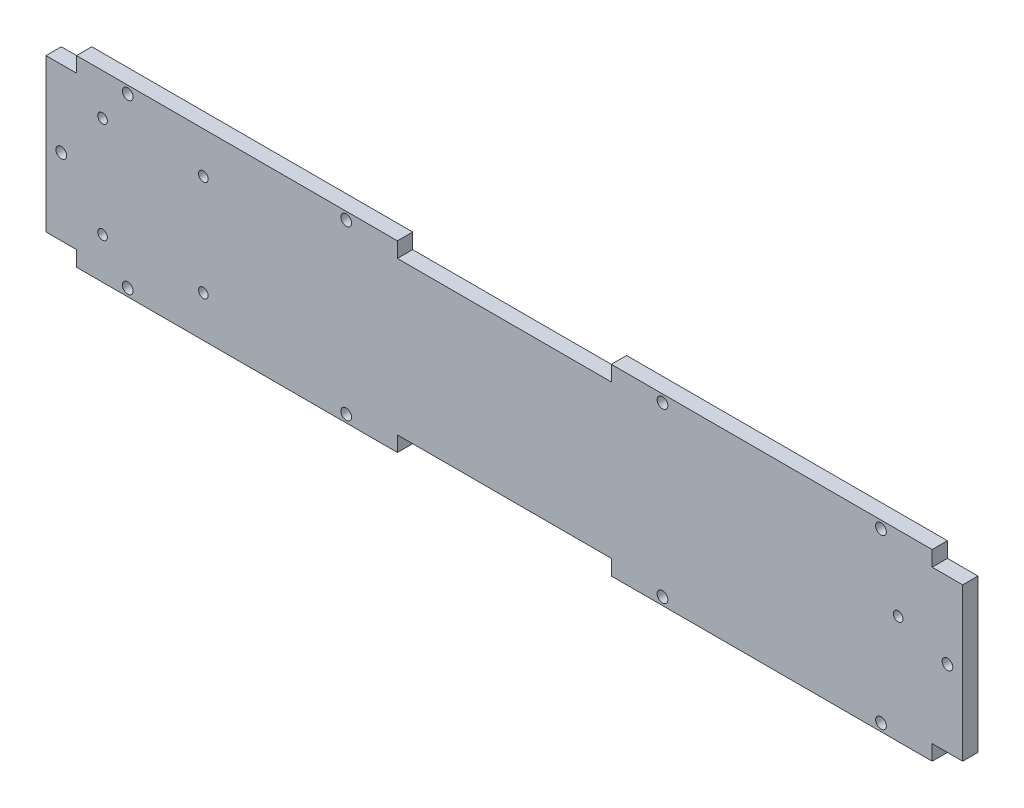
from build123d import *

# Parameters (mm, degrees)
SKETCH1_W           = 105
SKETCH1_H           = 5
SKETCH1_W_2         = 10
SKETCH1_H_2         = 50
BOSS_EXTRUDE1_DEPTH = 5
SKETCH2_R           = 1.75
CUT_EXTRUDE1_DEPTH  = 5
SKETCH3_R           = 1.75
CUT_EXTRUDE2_DEPTH  = 10
SKETCH5_R           = 1.575
CUT_EXTRUDE4_DEPTH  = 160.843673631


with BuildPart() as part:
    # Sketch1 → Boss-Extrude1 (new body)
    with BuildSketch(Plane.XY):
        Polygon((-35, 0), (0, 0), (0, 50), (-35, 50), (-140, 50), (-140, 0), align=None)
        Polygon((0, 50), (0, 0), (35, 0), (140, 0), (140, 50), (35, 50), align=None)
        with Locations((-87.5, -2.5)):
            Rectangle(SKETCH1_W, SKETCH1_H)
        with Locations((87.5, -2.5)):
            Rectangle(SKETCH1_W, SKETCH1_H)
        with Locations((-87.5, 52.5)):
            Rectangle(SKETCH1_W, SKETCH1_H)
        with Locations((87.5, 52.5)):
            Rectangle(SKETCH1_W, SKETCH1_H)
        with Locations((-145, 25)):
            Rectangle(SKETCH1_W_2, SKETCH1_H_2)
        with Locations((145, 25)):
            Rectangle(SKETCH1_W_2, SKETCH1_H_2)
    extrude(amount=BOSS_EXTRUDE1_DEPTH)

    # Sketch2 → Cut-Extrude1 (cut)
    with BuildSketch(Plane.XY.offset(5)):
        with Locations((-123.25, -2.5)):
            Circle(SKETCH2_R)
        with Locations(Location((-51.75, -2.5, 0), (0, 0, 180))):
            Circle(SKETCH2_R)
        with Locations((51.75, -2.5)):
            Circle(SKETCH2_R)
        with Locations(Location((123.25, -2.5, 0), (0, 0, 180))):
            Circle(SKETCH2_R)
        with Locations((123.25, 52.5)):
            Circle(SKETCH2_R)
        with Locations(Location((51.75, 52.5, 0), (0, 0, 180))):
            Circle(SKETCH2_R)
        with Locations((-51.75, 52.5)):
            Circle(SKETCH2_R)
        with Locations(Location((-123.25, 52.5, 0), (0, 0, 180))):
            Circle(SKETCH2_R)
    extrude(amount=-CUT_EXTRUDE1_DEPTH, mode=Mode.SUBTRACT)

    # Sketch3 → Cut-Extrude2 (cut)
    with BuildSketch(Plane.XY.offset(5)):
        with Locations((-145, 25)):
            Circle(SKETCH3_R)
        with Locations((145, 25)):
            Circle(SKETCH3_R)
    extrude(amount=-CUT_EXTRUDE2_DEPTH, mode=Mode.SUBTRACT)

    # Sketch5 → Cut-Extrude4 (cut, through all)
    with BuildSketch(Plane.XY.offset(5)):
        with Locations((-131.5, 41.5)):
            Circle(SKETCH5_R)
        with Locations(Location((-98.5, 41.5, 0), (0, 0, 180))):
            Circle(SKETCH5_R)
        with Locations((-98.5, 8.5)):
            Circle(SKETCH5_R)
        with Locations(Location((-131.5, 8.5, 0), (0, 0, 180))):
            Circle(SKETCH5_R)
        with Locations((128.87, 30.5)):
            Circle(SKETCH5_R)
    extrude(amount=-CUT_EXTRUDE4_DEPTH, mode=Mode.SUBTRACT)


solid = part.part
